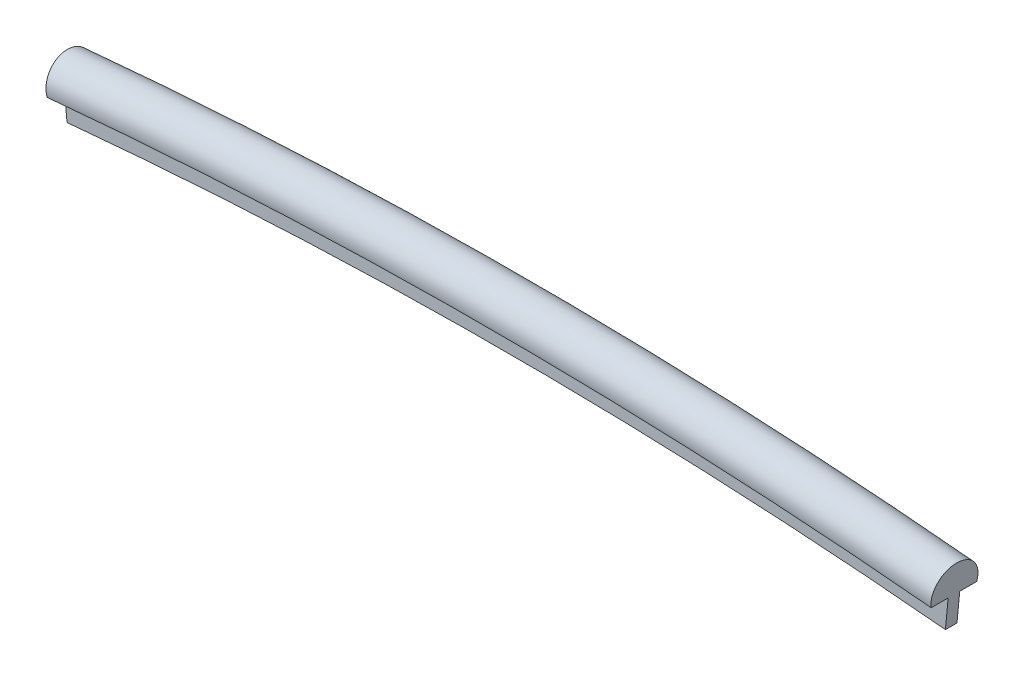
from build123d import *

# Parameters (mm, degrees)
REVOLVE1_ANGLE           = 5.442272589
REVOLVE1_OTHER_WAY_ANGLE = 5.442272589


with BuildPart() as part:
    # Sketch2 → Revolve1 (revolve)
    with BuildSketch(Plane(origin=(0, 0, 0), x_dir=(0, 0, -1), z_dir=(1, 0, 0))):
        with BuildLine():
            Line((0, 239.8), (0.3, 239.8))
            Line((0.3, 239.8), (0.3, 241.3))
            Line((0.3, 241.3), (1.18, 241.3))
            ThreePointArc((1.18, 241.3), (0, 242.800182019), (-1.18, 241.3))
            Line((-1.18, 241.3), (-0.3, 241.3))
            Line((-0.3, 241.3), (-0.3, 239.8))
            Line((-0.3, 239.8), (0, 239.8))
        make_face()
    revolve(axis=Axis((0, 0, 70.597641597), (0, 0, -1)), revolution_arc=REVOLVE1_ANGLE)

    # Sketch2 → Revolve1 other way (revolve)
    with BuildSketch(Plane(origin=(0, 0, 0), x_dir=(0, 0, -1), z_dir=(1, 0, 0))):
        with BuildLine():
            Line((0, 239.8), (0.3, 239.8))
            Line((0.3, 239.8), (0.3, 241.3))
            Line((0.3, 241.3), (1.18, 241.3))
            ThreePointArc((1.18, 241.3), (0, 242.800182019), (-1.18, 241.3))
            Line((-1.18, 241.3), (-0.3, 241.3))
            Line((-0.3, 241.3), (-0.3, 239.8))
            Line((-0.3, 239.8), (0, 239.8))
        make_face()
    revolve(axis=Axis((0, 0, 70.597641597), (0, 0, 1)), revolution_arc=REVOLVE1_OTHER_WAY_ANGLE)


solid = part.part
